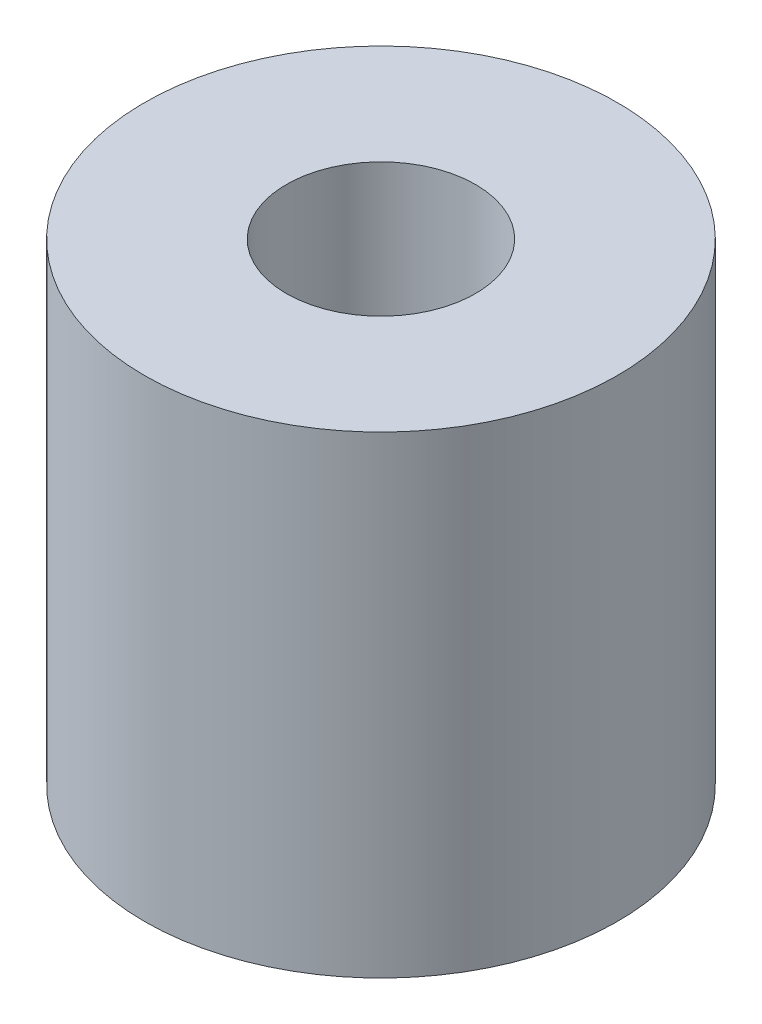
from build123d import *

# Parameters (mm, degrees)
SKETCH1_R           = 2.5
SKETCH1_R_2         = 1
BOSS_EXTRUDE1_DEPTH = 5


with BuildPart() as part:
    # Sketch1 → Boss-Extrude1 (new body)
    with BuildSketch(Plane(origin=(0, 0, 0), x_dir=(1, 0, 0), z_dir=(0, 1, 0))):
        with Locations(Location((0, 0, 0), (0, 0, 270))):
            Circle(SKETCH1_R)
        with Locations(Location((0, 0, 0), (0, 0, 270))):
            Circle(SKETCH1_R_2, mode=Mode.SUBTRACT)
    extrude(amount=BOSS_EXTRUDE1_DEPTH)


solid = part.part
